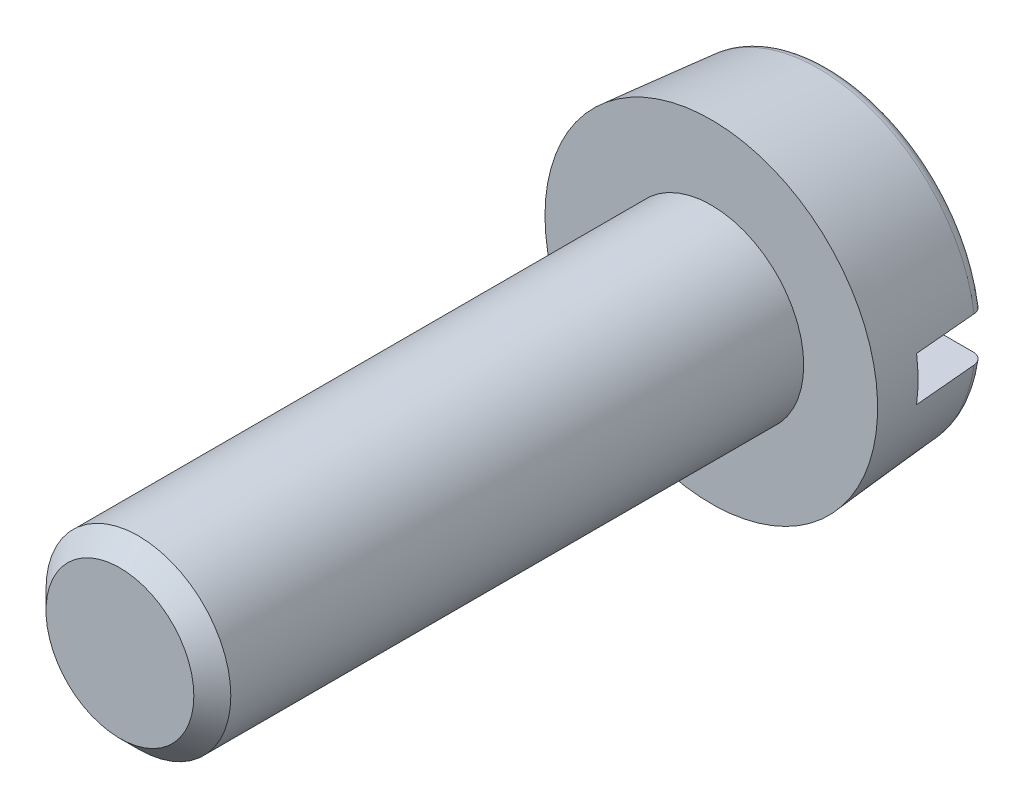
from build123d import *

# Parameters (mm, degrees)
ESQUISSE2_W             = 4.5
ESQUISSE2_H             = 0.6
ENLEV_MAT_EXTRU_1_DEPTH = 1
ESQUISSE3_W             = 1.25
ESQUISSE3_H             = 8
CHANFREIN1_SIZE         = 0.25


with BuildPart() as part:
    # Esquisse1 → Base-Révolution (revolve)
    with BuildSketch(Plane(origin=(0, 0, 0), x_dir=(1, 0, 0), z_dir=(0, 1, 0))):
        with BuildLine():
            Line((0, 0), (2.25, 0))
            Line((2.25, 0), (2.122796302, 1.453944919))
            ThreePointArc((2.122796302, 1.453944919), (2.071499584, 1.557964374), (1.963405151, 1.6))
            Line((1.963405151, 1.6), (0, 1.6))
            Line((0, 1.6), (0, 0))
        make_face()
    revolve(axis=Axis((0, 0, 0), (0, 0, -1)))

    # Esquisse2 → Enlev. mat.-Extru.1 (cut)
    with BuildSketch(Plane.XY.offset(-1.6)):
        Rectangle(ESQUISSE2_W, ESQUISSE2_H)
    extrude(amount=ENLEV_MAT_EXTRU_1_DEPTH, mode=Mode.SUBTRACT)

    # Esquisse3 → Boss.-Révol.1 (revolve)
    with BuildSketch(Plane(origin=(0, 0, 0), x_dir=(1, 0, 0), z_dir=(0, 1, 0))):
        with Locations((0.625, -4)):
            Rectangle(ESQUISSE3_W, ESQUISSE3_H)
    revolve(axis=Axis((0, 0, 0), (0, 0, 1)))

    # Chanfrein1
    chanfrein1_edges = [part.edges().sort_by_distance(p)[0] for p in [
        (-1.25, 0, 8),
    ]]
    chamfer(chanfrein1_edges, length=CHANFREIN1_SIZE)


solid = part.part
